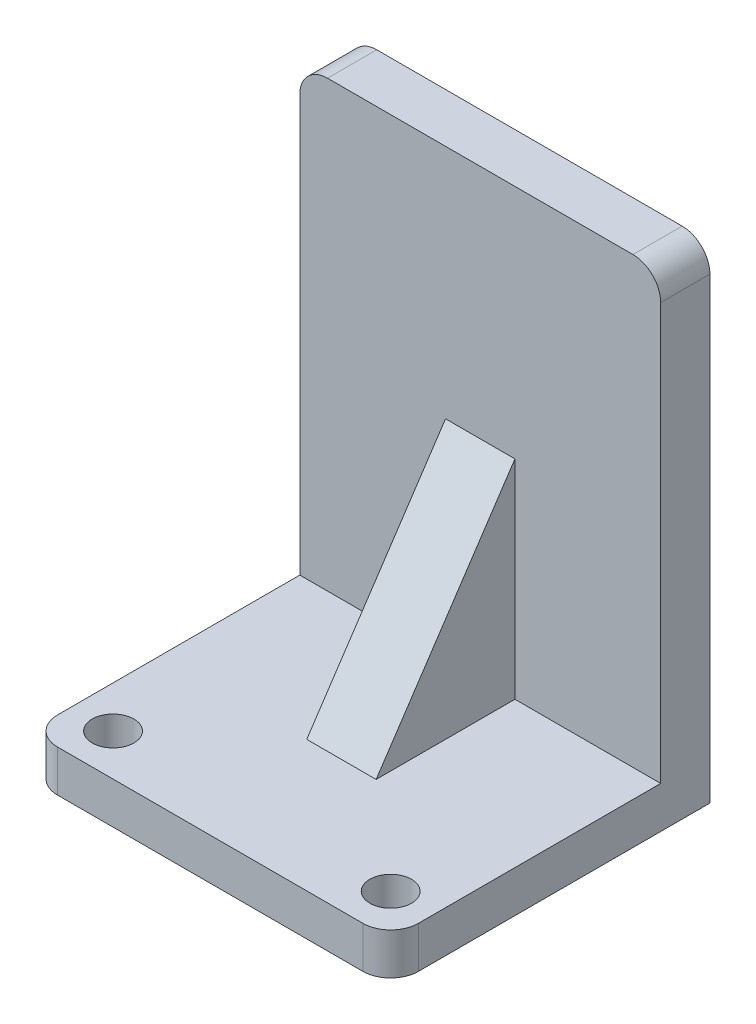
from build123d import *

# Parameters (mm, degrees)
SKETCH1_R           = 1.5
BOSS_EXTRUDE1_DEPTH = 3
SKETCH2_W           = 3.546458452
SKETCH2_H           = 32
BOSS_EXTRUDE2_DEPTH = 26
BOSS_EXTRUDE3_START = -10.5
BOSS_EXTRUDE3_DEPTH = 5
FILLET1_R           = 2
FILLET2_R           = 2


with BuildPart() as part:
    # Sketch1 → Boss-Extrude1 (new body)
    with BuildSketch(Plane(origin=(0, 0, 0), x_dir=(1, 0, 0), z_dir=(0, 1, 0))):
        with BuildLine():
            Line((13, 10.5), (-13, 10.5))
            Line((-13, 10.5), (-13, -10.5))
            ThreePointArc((-13, -10.5), (-12.414213562, -11.914213562), (-11, -12.5))
            Line((-11, -12.5), (11, -12.5))
            ThreePointArc((11, -12.5), (12.414213562, -11.914213562), (13, -10.5))
            Line((13, -10.5), (13, 10.5))
        make_face()
        with Locations(Location((-10, -9.5, 0), (0, 0, 270))):
            Circle(SKETCH1_R, mode=Mode.SUBTRACT)
        with Locations(Location((10, -9.5, 0), (0, 0, 270))):
            Circle(SKETCH1_R, mode=Mode.SUBTRACT)
    extrude(amount=BOSS_EXTRUDE1_DEPTH)

    # Sketch2 → Boss-Extrude2 (add)
    with BuildSketch(Plane.ZY.offset(13)):
        with Locations((-8.726770774, 19)):
            Rectangle(SKETCH2_W, SKETCH2_H)
    extrude(amount=-BOSS_EXTRUDE2_DEPTH)

    # Sketch3 → Boss-Extrude3 (add)
    with BuildSketch(Plane.ZY.offset(13).offset(BOSS_EXTRUDE3_START)):
        Polygon((-6.953541548, 18), (3.046458452, 3), (-6.953541548, 3), align=None)
    extrude(amount=-BOSS_EXTRUDE3_DEPTH)

    # Fillet1
    fillet1_edges = [part.edges().sort_by_distance(p)[0] for p in [
        (-13, 35, -8.726770774),
    ]]
    fillet(fillet1_edges, radius=FILLET1_R)

    # Fillet2
    fillet2_edges = [part.edges().sort_by_distance(p)[0] for p in [
        (13, 35, -8.726770774),
    ]]
    fillet(fillet2_edges, radius=FILLET2_R)


solid = part.part
